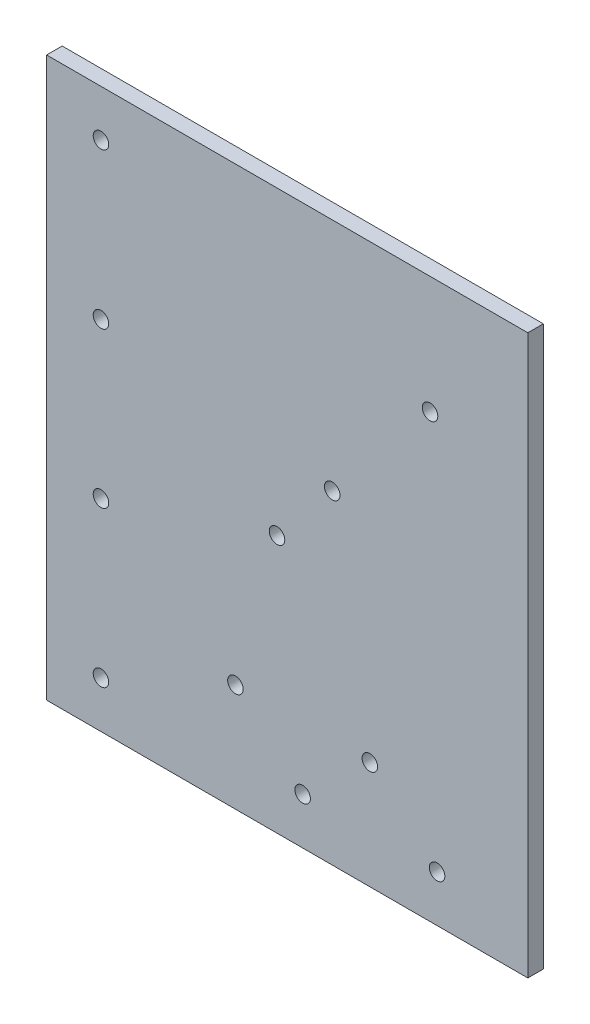
from build123d import *

# Parameters (mm, degrees)
SKETCH1_W                 = 393.7
SKETCH1_H                 = 457.2
PLATE_DEPTH               = 12.7
PATTERN_LINEAR_1136_COUNT = 4
PATTERN_LINEAR_1136_PITCH = 127


with BuildPart() as part:
    # Sketch1 → Plate (new body)
    with BuildSketch(Plane.XY):
        with Locations((196.85, 228.6)):
            Rectangle(SKETCH1_W, SKETCH1_H)
    extrude(amount=PLATE_DEPTH)

    # Sketch3 → Hole (revolve, cut)
    with BuildSketch(Plane(origin=(44.45, 38.1, 12.7), x_dir=(0, -1, 0), z_dir=(1, 0, 0))):
        Polygon((0, 0), (0, 29.215464931), (6.35, 25.4), (6.35, 0), align=None)
    hole = revolve(axis=Axis((44.45, 38.1, 19.05), (0, 0, -1)), mode=Mode.SUBTRACT)

    # Pattern Linear 1136: Hole ×4
    with Locations(*[(0, i * PATTERN_LINEAR_1136_PITCH, 0) for i in range(1, PATTERN_LINEAR_1136_COUNT)]):
        add(hole, mode=Mode.SUBTRACT)

    # 草圖複製排列1: Hole at 3 more places
    with Locations((189.2039, 227.04468, 0), (269.22695, 323.07234, 0), (144.04149, 172.849788, 0)):
        add(hole, mode=Mode.SUBTRACT)

    # 草圖複製排列2: Hole at 4 more places
    with Locations((165, 0, 0), (275, 0, 0), (110, 50, 0), (220, 50, 0)):
        add(hole, mode=Mode.SUBTRACT)


solid = part.part
